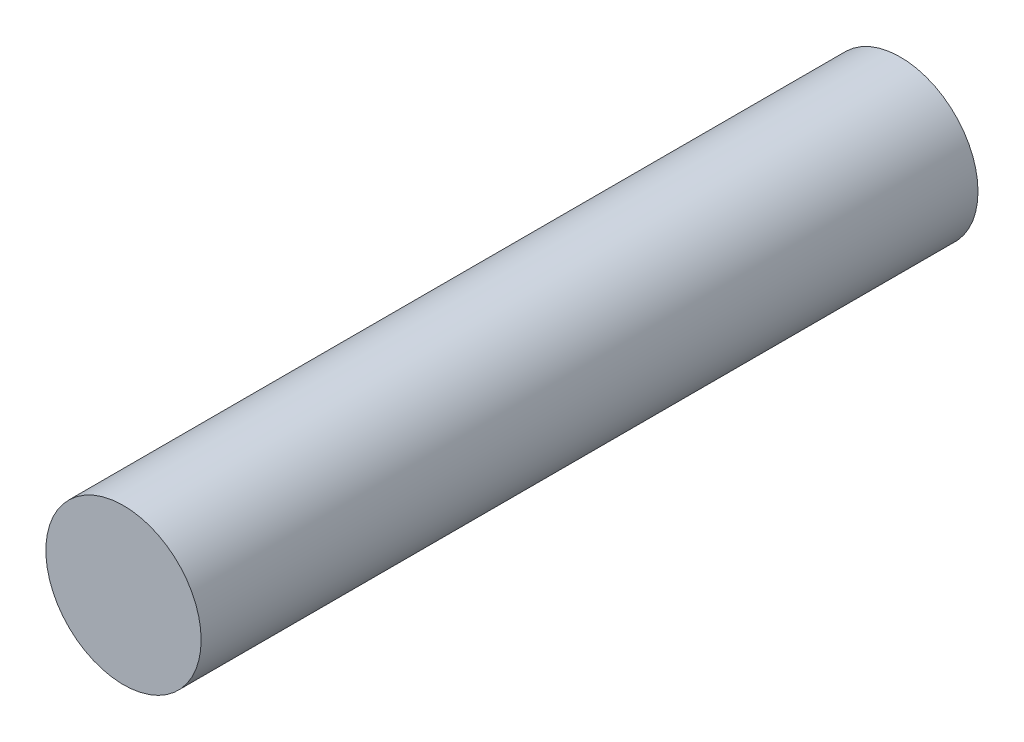
from build123d import *

# Parameters (mm, degrees)
BOSS_EXTRUDE1_DEPTH      = 6
BOSS_EXTRUDE1_DEPTH_BACK = 44
SKETCH1_R                = 4.9975


with BuildPart() as part:
    # Sketch1 → Boss-Extrude1 (new, two sides: drawn at the far end of the back side and taken through both)
    with BuildSketch(Plane.XY.offset(-BOSS_EXTRUDE1_DEPTH_BACK)):
        Circle(SKETCH1_R)
    extrude(amount=BOSS_EXTRUDE1_DEPTH + BOSS_EXTRUDE1_DEPTH_BACK)


solid = part.part
